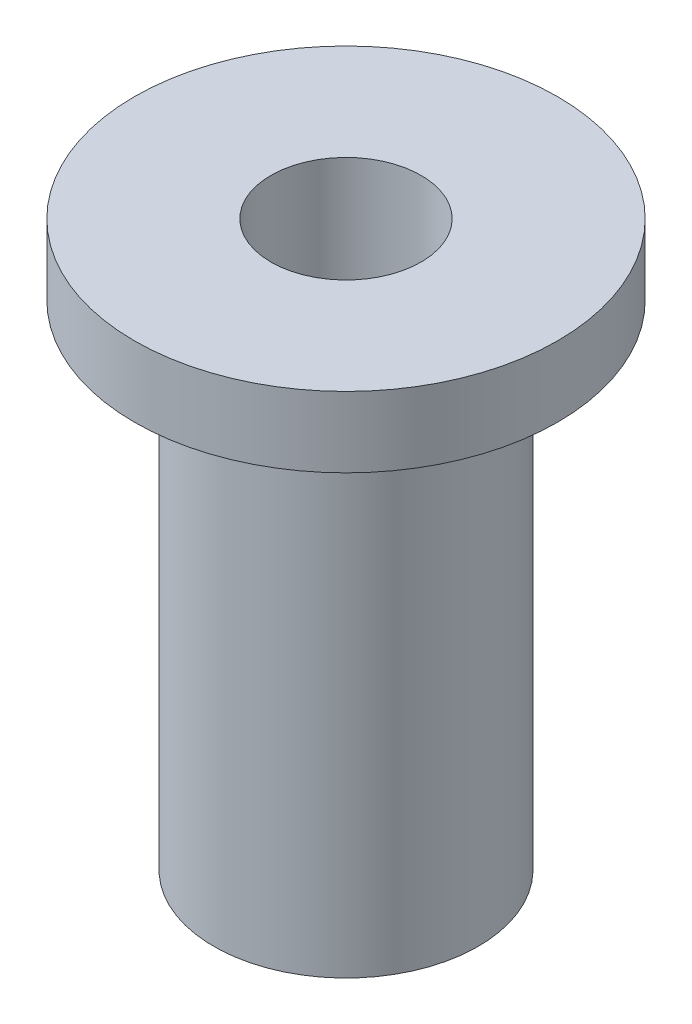
from build123d import *

# Parameters (mm, degrees)
F_6_32_TAPPED_HOLE1_D = 2.7051


with BuildPart() as part:
    # Sketch1 → Revolve1 (revolve)
    with BuildSketch(Plane.XY, mode=Mode.PRIVATE) as revolve1_sk:
        Polygon((0, 193.96), (2.38125, 193.96), (2.38125, 202.85), (3.81, 202.85), (3.81, 204.12), (0, 204.12), align=None)
    revolve(revolve1_sk.sketch.rotate(Axis((0, 0, 0), (0, 1, 0)), 90), axis=Axis((0, 0, 0), (0, 1, 0)))

    # #6-32 Tapped Hole1 (through all)
    with Locations(Plane(origin=(0, 204.12, 0), x_dir=(1, 0, 0), z_dir=(0, 1, 0))):
        with Locations((0, 0)):
            Hole(F_6_32_TAPPED_HOLE1_D / 2)


solid = part.part
